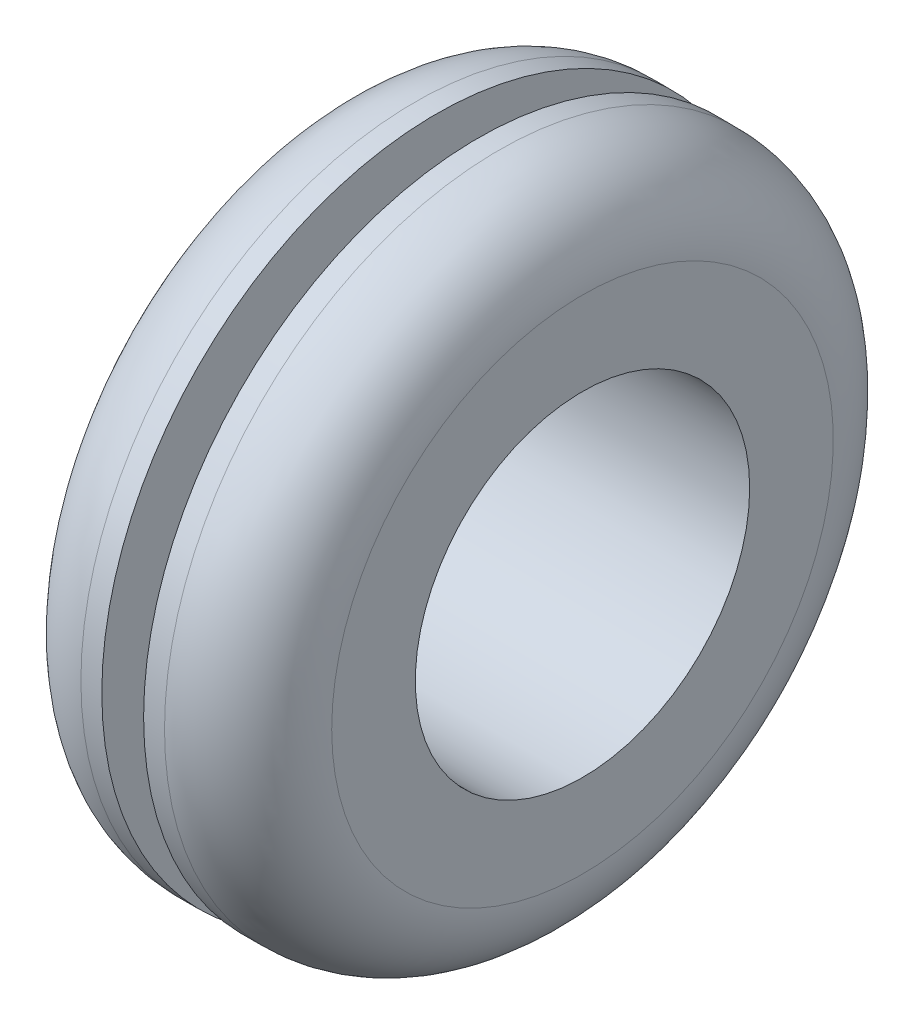
from build123d import *

# Parameters (mm, degrees)
SKETCH_2_R          = 4
CUT_EXTRUDE_1_DEPTH = 10
FILLET_1_R          = 2


with BuildPart() as part:
    # Эскиз1 → Повернуть1 (revolve)
    with BuildSketch(Plane.XY, mode=Mode.PRIVATE) as revolve_1_sk:
        Polygon((-26.283026585, 8), (-26.283026585, 0), (-20.283026585, 0), (-20.283026585, 8), (-22.783026585, 8), (-22.783026585, 6), (-23.783026585, 6), (-23.783026585, 8), align=None)
    revolve(revolve_1_sk.sketch.rotate(Axis((-31.114528332, 0, 0), (1, 0, 0)), 90), axis=Axis((-31.114528332, 0, 0), (1, 0, 0)))

    # Эскиз2 → Вырез-Вытянуть1 (cut)
    with BuildSketch(Plane(origin=(-20.283026585, 0, 0), x_dir=(0, 0, -1), z_dir=(1, 0, 0))):
        Circle(SKETCH_2_R)
    extrude(amount=-CUT_EXTRUDE_1_DEPTH, mode=Mode.SUBTRACT)

    # Скругление1
    fillet_1_edges = [part.edges().sort_by_distance(p)[0] for p in [
        (-26.283026585, 0, -8),
        (-20.283026585, 0, -8),
    ]]
    fillet(fillet_1_edges, radius=FILLET_1_R)


solid = part.part
